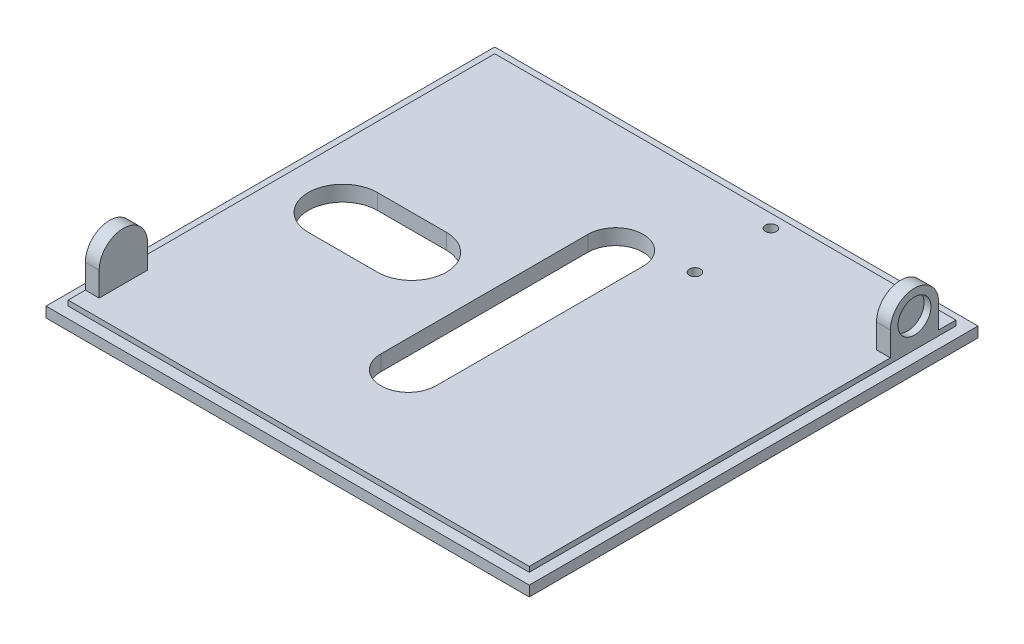
from build123d import *

# Parameters (mm, degrees)
SKETCH1_W                       = 140
SKETCH1_H                       = 130
BOSS_EXTRUDE1_DEPTH             = 3
SKETCH2_W                       = 133.6
SKETCH2_H                       = 123.6
BOSS_EXTRUDE2_DEPTH             = 1.5
SKETCH5_W                       = 4
SKETCH5_H                       = 14
BOSS_EXTRUDE3_DEPTH             = 14
SKETCH6_R                       = 4.775
CUT_EXTRUDE3_DEPTH              = 2
FILLET1_RADIUS                  = 7
FILLET1_LENGTH                  = 4
CIRPATTERN2_COUNT               = 2
FILLET1_OF_CIRPATTERN2_2_RADIUS = 7
FILLET1_OF_CIRPATTERN2_2_LENGTH = 4
CUT_EXTRUDE4_DEPTH              = 97.545326143
CUT_EXTRUDE5_DEPTH              = 98.29979445
SKETCH9_R                       = 1.6
CUT_EXTRUDE6_DEPTH              = 98.29979445


with BuildPart() as part:
    # Sketch1 → Boss-Extrude1 (new body)
    with BuildSketch(Plane(origin=(0, 0, 0), x_dir=(1, 0, 0), z_dir=(0, 1, 0))):
        Rectangle(SKETCH1_W, SKETCH1_H)
    extrude(amount=BOSS_EXTRUDE1_DEPTH)

    # Sketch2 → Boss-Extrude2 (add)
    with BuildSketch(Plane(origin=(0, 3, 0), x_dir=(1, 0, 0), z_dir=(0, 1, 0))):
        Rectangle(SKETCH2_W, SKETCH2_H)
    extrude(amount=BOSS_EXTRUDE2_DEPTH)

    # Sketch5 → Boss-Extrude3 (add)
    with BuildSketch(Plane(origin=(0, 4.5, 0), x_dir=(1, 0, 0), z_dir=(0, 1, 0))):
        with Locations((-64.8, -49.8)):
            Rectangle(SKETCH5_W, SKETCH5_H)
    boss_extrude3 = extrude(amount=BOSS_EXTRUDE3_DEPTH)

    # Sketch6 → Cut-Extrude3 (cut)
    with BuildSketch(Plane.ZY.offset(66.8)):
        with Locations((49.8, 11.5)):
            Circle(SKETCH6_R)
    cut_extrude3 = extrude(amount=-CUT_EXTRUDE3_DEPTH, mode=Mode.SUBTRACT)

    # Fillet1: full round fillet: the end face becomes a half cylinder, R = half its width
    fillet1_face = Plane((-64.8, 18.5, 49.8), x_dir=(1, 0, 0), z_dir=(0, 1, 0))  # on the end face: x along it, z out of the body
    fillet1_slab = fillet1_face.offset(-FILLET1_RADIUS / 2) * Box(FILLET1_LENGTH, 2 * FILLET1_RADIUS, FILLET1_RADIUS, mode=Mode.PRIVATE)  # the body's end, R deep
    fillet1_round = Plane((-64.8, 11.5, 49.8), x_dir=(0, 1, 0), z_dir=(1, 0, 0)) * Cylinder(FILLET1_RADIUS, FILLET1_LENGTH, mode=Mode.PRIVATE)  # its axis R under the face
    add(fillet1_slab - fillet1_round, mode=Mode.SUBTRACT)

    # CirPattern2: Boss-Extrude3, Cut-Extrude3 ×2 about axis
    cirpattern2_axis = Axis((0, 0, 0), (0, 1, 0))
    add([boss_extrude3.rotate(cirpattern2_axis, i * 360 / CIRPATTERN2_COUNT) for i in range(1, CIRPATTERN2_COUNT)])
    add([cut_extrude3.rotate(cirpattern2_axis, i * 360 / CIRPATTERN2_COUNT) for i in range(1, CIRPATTERN2_COUNT)], mode=Mode.SUBTRACT)

    # Fillet1 of CirPattern2 2: full round fillet: the end face becomes a half cylinder, R = half its width
    fillet1_of_cirpattern2_2_face = Plane((64.8, 18.5, -49.8), x_dir=(-1, 0, 0), z_dir=(0, 1, 0))  # on the end face: x along it, z out of the body
    fillet1_of_cirpattern2_2_slab = fillet1_of_cirpattern2_2_face.offset(-FILLET1_OF_CIRPATTERN2_2_RADIUS / 2) * Box(FILLET1_OF_CIRPATTERN2_2_LENGTH, 2 * FILLET1_OF_CIRPATTERN2_2_RADIUS, FILLET1_OF_CIRPATTERN2_2_RADIUS, mode=Mode.PRIVATE)  # the body's end, R deep
    fillet1_of_cirpattern2_2_round = Plane((64.8, 11.5, -49.8), x_dir=(0, 1, 0), z_dir=(-1, 0, 0)) * Cylinder(FILLET1_OF_CIRPATTERN2_2_RADIUS, FILLET1_OF_CIRPATTERN2_2_LENGTH, mode=Mode.PRIVATE)  # its axis R under the face
    add(fillet1_of_cirpattern2_2_slab - fillet1_of_cirpattern2_2_round, mode=Mode.SUBTRACT)

    # Sketch7 → Cut-Extrude4 (cut, through all)
    with BuildSketch(Plane(origin=(0, 4.5, 0), x_dir=(1, 0, 0), z_dir=(0, 1, 0))):
        with BuildLine():
            Line((-8, -30), (-8, 30))
            ThreePointArc((-8, 30), (0, 38), (8, 30))
            Line((8, 30), (8, -30))
            ThreePointArc((8, -30), (0, -38), (-8, -30))
        make_face()
    extrude(amount=-CUT_EXTRUDE4_DEPTH, mode=Mode.SUBTRACT)

    # Sketch8 → Cut-Extrude5 (cut, through all)
    with BuildSketch(Plane.XZ):
        with BuildLine():
            Line((-49, 10), (-29, 10))
            ThreePointArc((-29, 10), (-19, 0), (-29, -10))
            Line((-29, -10), (-49, -10))
            ThreePointArc((-49, -10), (-59, 0), (-49, 10))
        make_face()
    extrude(amount=-CUT_EXTRUDE5_DEPTH, mode=Mode.SUBTRACT)

    # Sketch9 → Cut-Extrude6 (cut, through all)
    with BuildSketch(Plane.XZ):
        with Locations(Location((17, -36, 0), (0, 0, 270))):
            Circle(SKETCH9_R)
        with Locations(Location((17, -58, 0), (0, 0, 270))):
            Circle(SKETCH9_R)
    extrude(amount=-CUT_EXTRUDE6_DEPTH, mode=Mode.SUBTRACT)


solid = part.part
